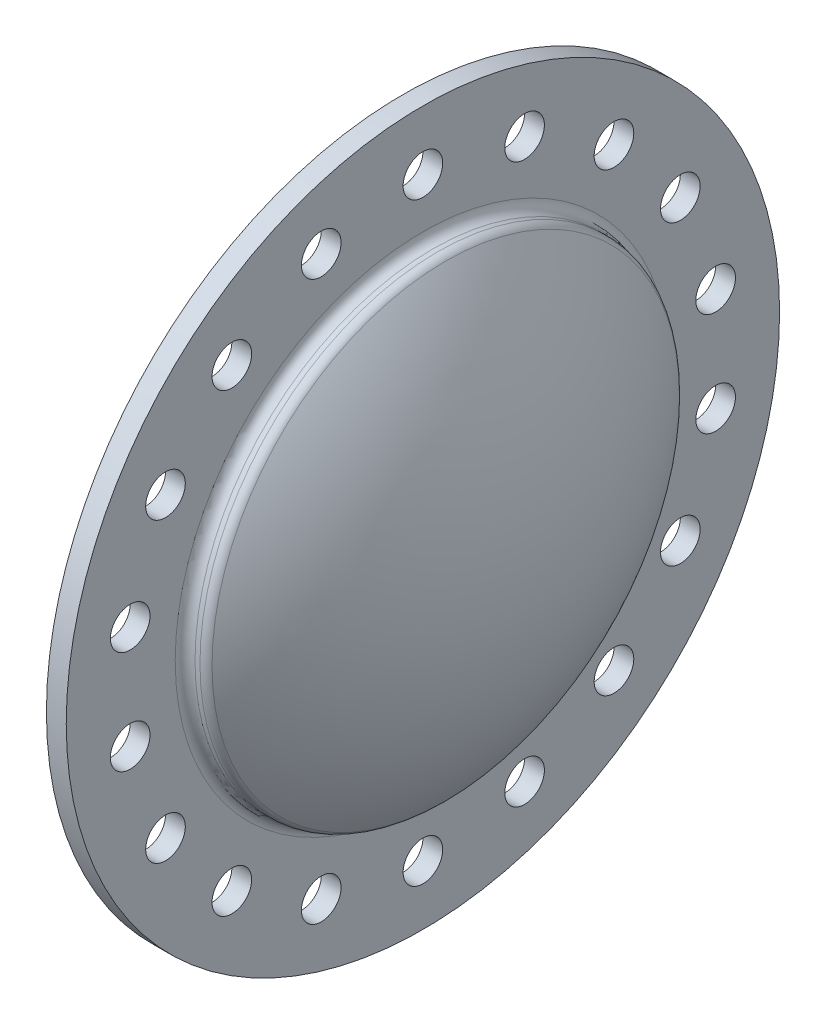
from build123d import *

# Parameters (mm, degrees)
SKETCH1_R           = 90
SKETCH1_R_2         = 5
SKETCH1_R_3         = 60
BOSS_EXTRUDE1_DEPTH = 5
SKETCH2_R           = 60
BOSS_EXTRUDE2_DEPTH = 5
DOME1_FACE_RADIUS   = 60
DOME1_HEIGHT        = 20
BOSS_EXTRUDE3_START = 5
SKETCH3_R           = 60
BOSS_EXTRUDE3_DEPTH = 5
FILLET2_R           = 2.5


with BuildPart() as part:
    # Sketch1 → Boss-Extrude1 (new body)
    with BuildSketch(Plane(origin=(0, 0, 0), x_dir=(0, 0, -1), z_dir=(1, 0, 0))):
        Circle(SKETCH1_R)
        with Locations((0, 75)):
            Circle(SKETCH1_R_2, mode=Mode.SUBTRACT)
        with Locations((25.651571057, 70.477288579)):
            Circle(SKETCH1_R_2, mode=Mode.SUBTRACT)
        with Locations((48.209304682, 57.453976022)):
            Circle(SKETCH1_R_2, mode=Mode.SUBTRACT)
        with Locations((64.952405284, 37.500866025)):
            Circle(SKETCH1_R_2, mode=Mode.SUBTRACT)
        with Locations((73.861407828, 13.024598133)):
            Circle(SKETCH1_R_2, mode=Mode.SUBTRACT)
        with Locations((73.861755124, -13.022628517)):
            Circle(SKETCH1_R_2, mode=Mode.SUBTRACT)
        with Locations((64.953405284, -37.499133975)):
            Circle(SKETCH1_R_2, mode=Mode.SUBTRACT)
        with Locations((48.210836771, -57.452690446)):
            Circle(SKETCH1_R_2, mode=Mode.SUBTRACT)
        with Locations((25.653450442, -70.476604539)):
            Circle(SKETCH1_R_2, mode=Mode.SUBTRACT)
        with Locations((0.002, -75)):
            Circle(SKETCH1_R_2, mode=Mode.SUBTRACT)
        with Locations((-25.649571057, -70.477288579)):
            Circle(SKETCH1_R_2, mode=Mode.SUBTRACT)
        with Locations((-48.207304682, -57.453976022)):
            Circle(SKETCH1_R_2, mode=Mode.SUBTRACT)
        with Locations((-64.950405284, -37.500866025)):
            Circle(SKETCH1_R_2, mode=Mode.SUBTRACT)
        with Locations((-73.859407828, -13.024598133)):
            Circle(SKETCH1_R_2, mode=Mode.SUBTRACT)
        with Locations((-73.859755124, 13.022628517)):
            Circle(SKETCH1_R_2, mode=Mode.SUBTRACT)
        with Locations((-64.951405284, 37.499133975)):
            Circle(SKETCH1_R_2, mode=Mode.SUBTRACT)
        with Locations((-48.208836771, 57.452690446)):
            Circle(SKETCH1_R_2, mode=Mode.SUBTRACT)
        with Locations((-25.651450442, 70.476604539)):
            Circle(SKETCH1_R_2, mode=Mode.SUBTRACT)
        Circle(SKETCH1_R_3, mode=Mode.SUBTRACT)
    extrude(amount=BOSS_EXTRUDE1_DEPTH)



with BuildPart() as body_2:
    # Sketch2 → Boss-Extrude2 (new body)
    with BuildSketch(Plane(origin=(5, 0, 0), x_dir=(0, 0, -1), z_dir=(1, 0, 0))):
        Circle(SKETCH2_R)
    extrude(amount=BOSS_EXTRUDE2_DEPTH)

    # Dome1: a dome of height H over a round flat face of radius A is a cap of a sphere of radius (A * A + H * H) / (2 * H)
    dome1_r = (DOME1_FACE_RADIUS * DOME1_FACE_RADIUS + DOME1_HEIGHT * DOME1_HEIGHT) / (2 * DOME1_HEIGHT)
    dome1_base = Plane((10, 0, 0), z_dir=(1, 0, 0))
    with Locations(dome1_base.offset(DOME1_HEIGHT - dome1_r)):
        dome1_ball = Sphere(dome1_r, mode=Mode.PRIVATE)
    add(split(dome1_ball, bisect_by=dome1_base, keep=Keep.TOP, mode=Mode.PRIVATE))


with BuildPart() as part_1:
    add(part.part)

    add(body_2.part)  # Boss-Extrude3 merges body 2
    # Sketch3 → Boss-Extrude3 (add)
    with BuildSketch(Plane.ZY.offset(-5).offset(BOSS_EXTRUDE3_START)):
        with Locations(Location((0, 0, 0), (0, 0, 180))):
            Circle(SKETCH3_R)
    extrude(amount=-BOSS_EXTRUDE3_DEPTH)

    # Fillet2
    fillet2_edges = [part_1.edges().sort_by_distance(p)[0] for p in [
        (5, 0, 60),
        (10, -60, 0),
    ]]
    fillet(fillet2_edges, radius=FILLET2_R)


solid = part_1.part
